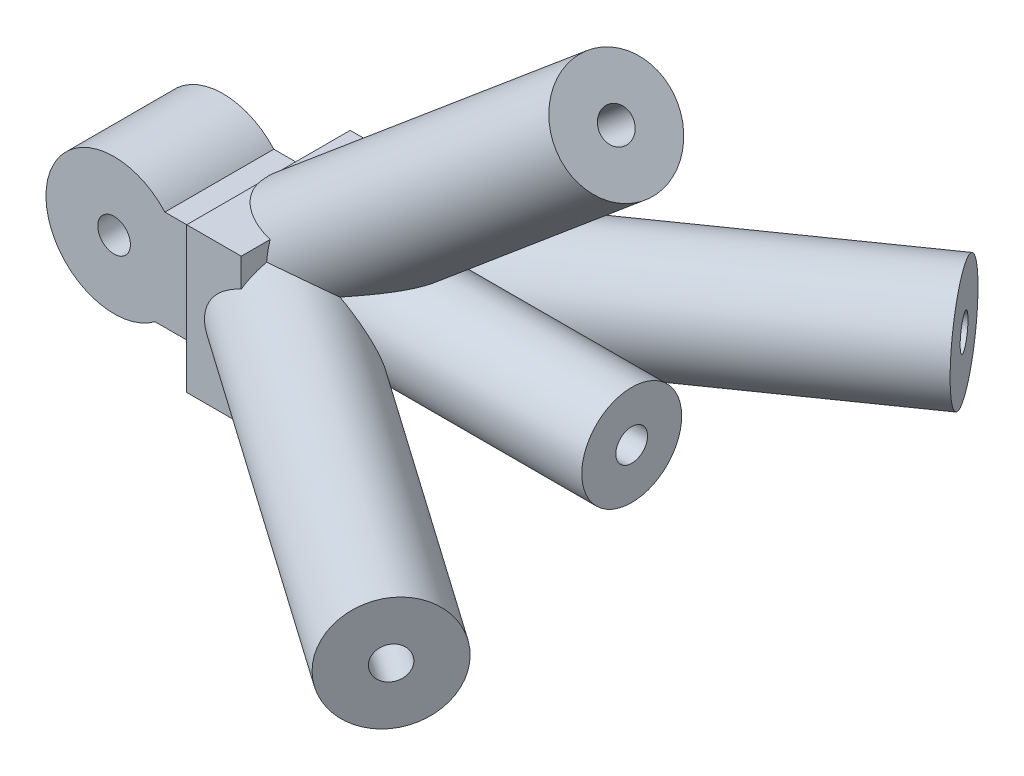
from build123d import *

# Parameters (mm, degrees)
SKETCH_2_W           = 3.6
SKETCH_2_H           = 3.2
SKETCH_2_W_2         = 1.9125
SKETCH_2_H_2         = 1.7
EXTRUDE_1_DEPTH      = 7
EXTRUDE_2_REACH      = 20.018
SKETCH_3_R           = 1.25
SKETCH_3_R_2         = 0.36
EXTRUDE_3_REACH      = 23.096
SKETCH_4_R           = 1.25
SKETCH_4_R_2         = 0.35
SKETCH_5_W           = 3.6
SKETCH_5_H           = 3.2
EXTRUDE_4_DEPTH      = 1.2
CUT_EXTRUDE_START    = -7
SKETCH_6_W           = 3.6
SKETCH_6_H           = 3.2
CUT_EXTRUDE_1_DEPTH  = 7
SKETCH_7_R           = 0.36
EXTRUDE_5_DEPTH      = 1.2
EXTRUDE_6_REACH      = 17.725
SKETCH_9_R           = 1.25
SKETCH_9_R_2         = 0.35
EXTRUDE_7_REACH      = 17.01
EXTRUDE_7_END_RADIUS = 1.25
SKETCH_10_R          = 1.1
SKETCH_10_R_2        = 0.35


with BuildPart() as part:
    # 草图2 → 凸台-拉伸1 (new body)
    with BuildSketch(Plane(origin=(0, 0, 0), x_dir=(0, 0, -1), z_dir=(1, 0, 0))):
        Rectangle(SKETCH_2_W, SKETCH_2_H)
        Rectangle(SKETCH_2_W_2, SKETCH_2_H_2, mode=Mode.SUBTRACT)
    extrude(amount=-EXTRUDE_1_DEPTH)

    # 凸台-拉伸2: up to this plane
    extrude_2_end = Plane(origin=(0, 0, 0), z_dir=(-1, 0, 0))
    # 草图3 → 凸台-拉伸2 (add, up to the surface)
    with BuildSketch(Plane(origin=(9.010672487, 0, 6.3093408), x_dir=(-0.5735764363510472, 0, 0.819152044288991), z_dir=(-0.819152044288991, 0, -0.5735764363510472)), mode=Mode.PRIVATE) as extrude_2_sk1:
        Circle(SKETCH_3_R)
        Circle(SKETCH_3_R_2, mode=Mode.SUBTRACT)
    extrude_2_tool1 = split(extrude(extrude_2_sk1.sketch, amount=EXTRUDE_2_REACH, mode=Mode.PRIVATE), bisect_by=extrude_2_end, keep=Keep.BOTH, mode=Mode.PRIVATE)
    add(extrude_2_tool1.solids().sort_by_distance((9.707364, 0, 5.314362))[0])

    # 凸台-拉伸3: up to this plane
    extrude_3_end = Plane(origin=(0, 0, 0), z_dir=(-1, 0, 0))
    # 草图4 → 凸台-拉伸3 (add, up to the surface)
    with BuildSketch(Plane(origin=(9.010672487, 0, -6.3093408), x_dir=(-0.5735764363510472, 0, -0.819152044288991), z_dir=(0.819152044288991, 0, -0.5735764363510472)), mode=Mode.PRIVATE) as extrude_3_sk1:
        Circle(SKETCH_4_R)
        Circle(SKETCH_4_R_2, mode=Mode.SUBTRACT)
    extrude_3_tool1 = split(extrude(extrude_3_sk1.sketch, amount=-EXTRUDE_3_REACH, mode=Mode.PRIVATE), bisect_by=extrude_3_end, keep=Keep.BOTH, mode=Mode.PRIVATE)
    add(extrude_3_tool1.solids().sort_by_distance((9.707364, 0, -5.314362))[0])

    # 草图5 → 凸台-拉伸4 (add)
    with BuildSketch(Plane(origin=(0, 0, 0), x_dir=(0, 0, -1), z_dir=(1, 0, 0))):
        Rectangle(SKETCH_5_W, SKETCH_5_H)
    extrude(amount=EXTRUDE_4_DEPTH)

    # 草图6 → 切除-拉伸1 (cut)
    with BuildSketch(Plane.ZY.offset(7).offset(CUT_EXTRUDE_START)):
        Rectangle(SKETCH_6_W, SKETCH_6_H)
    extrude(amount=CUT_EXTRUDE_1_DEPTH, mode=Mode.SUBTRACT)

    # 草图7 → 凸台-拉伸5 (add, symmetric)
    with BuildSketch(Plane.XY):
        with BuildLine():
            Line((0, 1), (-1.081966011, 1))
            ThreePointArc((-1.081966011, 1), (-3.692687273, 0.1479348), (-1.3, -1.2))
            Line((-1.3, -1.2), (0, -1.2))
            Line((0, -1.2), (0, 1))
        make_face()
        with Locations((-2.2, 0)):
            Circle(SKETCH_7_R, mode=Mode.SUBTRACT)
    extrude(amount=EXTRUDE_5_DEPTH, both=True)

    # 凸台-拉伸6: up to this plane
    extrude_6_end = Plane(origin=(0, 0, 0), z_dir=(-1, 0, 0))
    # 草图9 → 凸台-拉伸6 (add, up to the surface)
    with BuildSketch(Plane(origin=(7.660444431, 6.427876097, 0), x_dir=(0, 0, -1), z_dir=(0.7660444431189767, 0.6427876096865409, 0)), mode=Mode.PRIVATE) as extrude_6_sk1:
        with Locations(Location((0, 0, 0), (0, 0, 90))):
            Circle(SKETCH_9_R)
        with Locations(Location((0, 0, 0), (0, 0, 90))):
            Circle(SKETCH_9_R_2, mode=Mode.SUBTRACT)
    extrude_6_tool1 = split(extrude(extrude_6_sk1.sketch, amount=-EXTRUDE_6_REACH, mode=Mode.PRIVATE), bisect_by=extrude_6_end, keep=Keep.BOTH, mode=Mode.PRIVATE)
    add(extrude_6_tool1.solids().sort_by_distance((8.441203, 5.497404, 0))[0])

    # 凸台-拉伸7: up to this cylinder (the profile starts outside it)
    extrude_7_end = Plane(origin=(4.940794649, 4.145818968, 0), z_dir=(0.7660444431189767, 0.642787609686541, 0)) * Cylinder(EXTRUDE_7_END_RADIUS, 37.52, mode=Mode.PRIVATE)
    # 草图10 → 凸台-拉伸7 (add, up to the surface)
    with BuildSketch(Plane(origin=(8, 1.5, 0), x_dir=(0, 0, -1), z_dir=(1, 0, 0)), mode=Mode.PRIVATE) as extrude_7_sk1:
        with Locations((0, -1)):
            Circle(SKETCH_10_R)
        with Locations((0, -1)):
            Circle(SKETCH_10_R_2, mode=Mode.SUBTRACT)
    extrude_7_tool1 = extrude(extrude_7_sk1.sketch, amount=-EXTRUDE_7_REACH, mode=Mode.PRIVATE) - extrude_7_end
    add(extrude_7_tool1.solids().sort_by_distance((8, 0.5, 1.068887))[0])


solid = part.part
